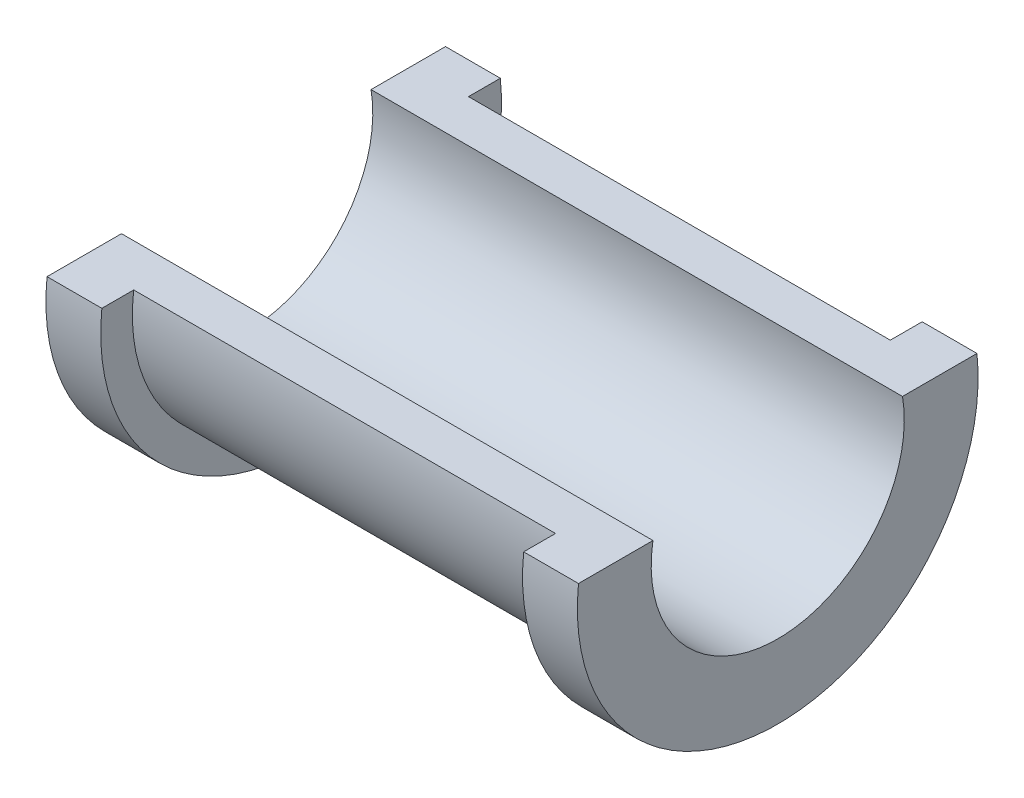
from build123d import *

# Parameters (mm, degrees)
SKETCH2_R                   = 30
CUT_EXTRUDE1_DEPTH          = 143.788304843
BOSS_EXTRUDE1_REACH         = 164.242
BOSS_EXTRUDE1_END_RADIUS    = 40
SKETCH3_R                   = 8
M10X1_0_TAPPED_HOLE1_REACH  = 164.242
M10X1_0_TAPPED_HOLE1_BORE_R = 4.5
CUT_EXTRUDE2_DEPTH          = 143.788304931
CUT_EXTRUDE2_DEPTH_BACK     = 143.788304931


with BuildPart() as part:
    # Sketch1 → Revolve1 (revolve)
    with BuildSketch(Plane.XY, mode=Mode.PRIVATE) as revolve1_sk:
        Polygon((0, 0), (0, 47.5), (13, 47.5), (13, 40), (113, 40), (113, 47.5), (126, 47.5), (126, 0), align=None)
    revolve(revolve1_sk.sketch.rotate(Axis((126, 0, 0), (-1, 0, 0)), 90), axis=Axis((126, 0, 0), (-1, 0, 0)))

    # Sketch2 → Cut-Extrude1 (cut, through all)
    with BuildSketch(Plane(origin=(126, 0, 0), x_dir=(0, 0, -1), z_dir=(1, 0, 0))):
        Circle(SKETCH2_R)
    extrude(amount=-CUT_EXTRUDE1_DEPTH, mode=Mode.SUBTRACT)

    # Boss-Extrude1: up to this cylinder (the profile starts outside it)
    boss_extrude1_end = Plane(origin=(63, 0, 0), z_dir=(1, 0, 0)) * Cylinder(BOSS_EXTRUDE1_END_RADIUS, 409.484, mode=Mode.PRIVATE)
    # Sketch3 → Boss-Extrude1 (add, up to the surface)
    with BuildSketch(Plane(origin=(0, 43, 0), x_dir=(1, 0, 0), z_dir=(0, 1, 0)), mode=Mode.PRIVATE) as boss_extrude1_sk1:
        with Locations(Location((63, 0, 0), (0, 0, 270))):
            Circle(SKETCH3_R)
    boss_extrude1_tool1 = extrude(boss_extrude1_sk1.sketch, amount=-BOSS_EXTRUDE1_REACH, mode=Mode.PRIVATE) - boss_extrude1_end
    add(boss_extrude1_tool1.solids().sort_by_distance((63, 43, 0))[0])

    # M10x1.0 Tapped Hole1 bore → M10x1.0 Tapped Hole1 (cut, up to next)
    with BuildSketch(Plane(origin=(0, 43, 0), x_dir=(1, 0, 0), z_dir=(0, 1, 0)), mode=Mode.PRIVATE) as m10x1_0_tapped_hole1_sk1:
        with Locations((63, 0)):
            Circle(M10X1_0_TAPPED_HOLE1_BORE_R)
    m10x1_0_tapped_hole1_tool1 = extrude(m10x1_0_tapped_hole1_sk1.sketch, amount=-M10X1_0_TAPPED_HOLE1_REACH, mode=Mode.PRIVATE) & part.part
    add(m10x1_0_tapped_hole1_tool1.solids().sort_by_distance((63, 43, 0))[0], mode=Mode.SUBTRACT)

    # Sketch6 → Cut-Extrude2 (cut, two sides: drawn at the far end of the back side and taken through both)
    with BuildSketch(Plane(origin=(126, 0, 0), x_dir=(0, 0, -1), z_dir=(1, 0, 0)).offset(-CUT_EXTRUDE2_DEPTH_BACK)):
        Polygon((-315.109988933, 5), (-62.08548164, 5), (59.692601542, 5), (312.717108835, 5), (312.717108835, 511.049014586), (-315.109988933, 511.049014586), align=None)
    extrude(amount=CUT_EXTRUDE2_DEPTH + CUT_EXTRUDE2_DEPTH_BACK, mode=Mode.SUBTRACT)


solid = part.part
